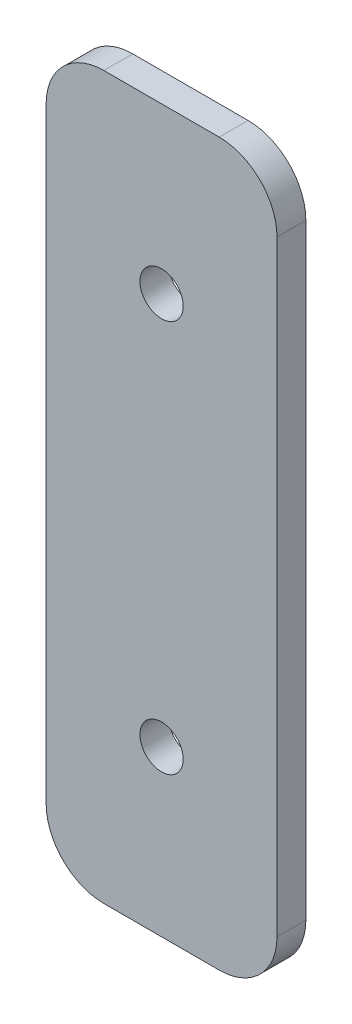
from build123d import *

# Parameters (mm, degrees)
SKIZZE1_W                       = 40
SKIZZE1_H                       = 125
SKIZZE1_R                       = 3.75
AUFSATZ_LINEAR_AUSTRAGEN1_DEPTH = 5
VERRUNDUNG1_R                   = 10


with BuildPart() as part:
    # Skizze1 → Aufsatz-Linear austragen1 (new body)
    with BuildSketch(Plane.XY):
        Rectangle(SKIZZE1_W, SKIZZE1_H)
        with Locations((0, 34)):
            Circle(SKIZZE1_R, mode=Mode.SUBTRACT)
        with Locations(Location((0, -34, 0), (0, 0, 180))):
            Circle(SKIZZE1_R, mode=Mode.SUBTRACT)
    extrude(amount=AUFSATZ_LINEAR_AUSTRAGEN1_DEPTH)

    # Verrundung1
    verrundung1_edges = [part.edges().sort_by_distance(p)[0] for p in [
        (-20, 62.5, 2.5),
        (20, 62.5, 2.5),
        (20, -62.5, 2.5),
        (-20, -62.5, 2.5),
    ]]
    fillet(verrundung1_edges, radius=VERRUNDUNG1_R)


solid = part.part
